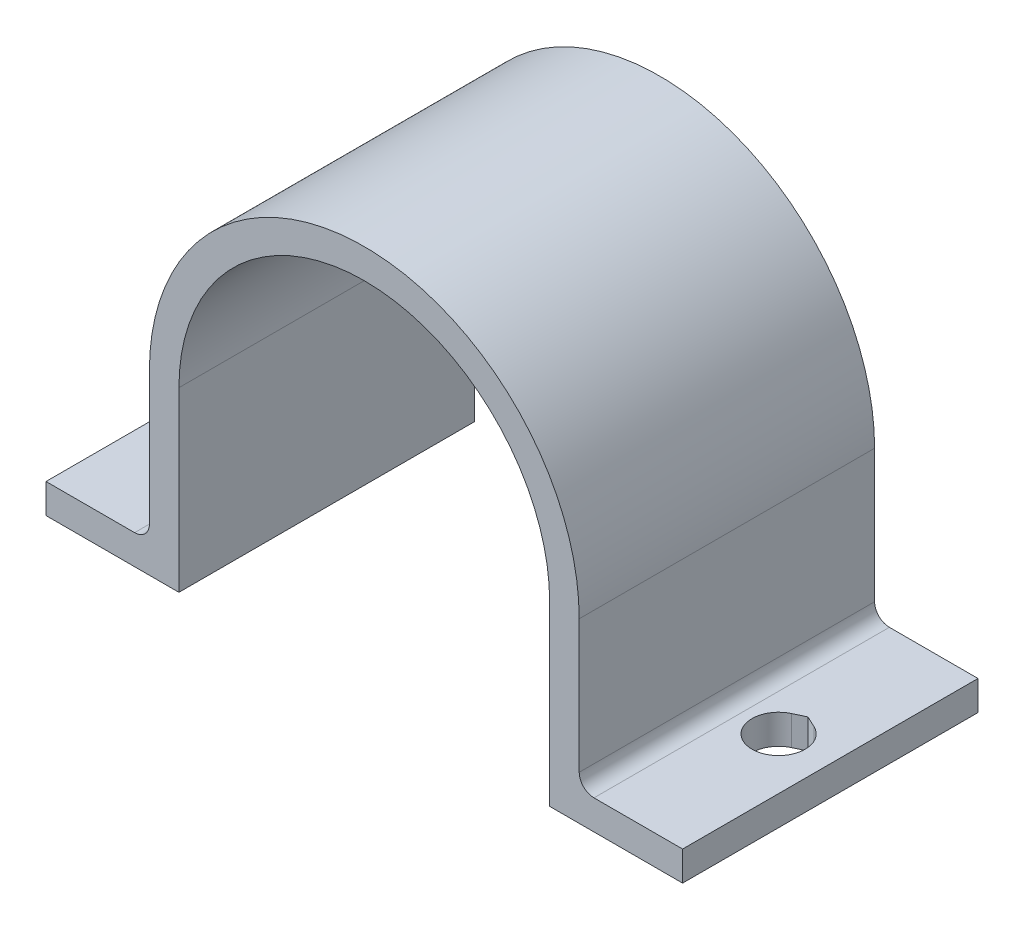
from build123d import *

# Parameters (mm, degrees)
SALIENTE_EXTRUIR1_DEPTH      = 20
TALADRO_DE_MARGEN_PARA_M31_D = 3.6
REDONDEO1_R                  = 1
CORTAR_EXTRUIR1_REACH        = 40.303


with BuildPart() as part:
    # Croquis1 → Saliente-Extruir1 (new body)
    with BuildSketch(Plane.XY):
        with BuildLine():
            Line((-12.55, 0), (-21.55, 0))
            Line((-21.55, 0), (-21.55, 2))
            Line((-21.55, 2), (-14.55, 2))
            Line((-14.55, 2), (-14.55, 12))
            ThreePointArc((-14.55, 12), (0, 26.55), (14.55, 12))
            Line((14.55, 12), (14.55, 2))
            Line((14.55, 2), (21.55, 2))
            Line((21.55, 2), (21.55, 0))
            Line((21.55, 0), (12.55, 0))
            Line((12.55, 0), (12.55, 12))
            ThreePointArc((12.55, 12), (0, 24.55), (-12.55, 12))
            Line((-12.55, 12), (-12.55, 0))
        make_face()
    extrude(amount=SALIENTE_EXTRUIR1_DEPTH)

    # Taladro de margen para M31 (through all)
    with Locations(Plane(origin=(0, 2, 0), x_dir=(1, 0, 0), z_dir=(0, 1, 0))):
        with Locations((18.05, -10), (-18.05, -10)):
            Hole(TALADRO_DE_MARGEN_PARA_M31_D / 2)

    # Redondeo1
    redondeo1_edges = [part.edges().sort_by_distance(p)[0] for p in [
        (14.55, 2, 10),
        (-14.55, 2, 10),
    ]]
    fillet(redondeo1_edges, radius=REDONDEO1_R)

    # Croquis4 → Cortar-Extruir1 (cut, up to next)
    with BuildSketch(Plane(origin=(0, 2, 0), x_dir=(1, 0, 0), z_dir=(0, 1, 0)), mode=Mode.PRIVATE) as cortar_extruir1_sk1:
        with BuildLine():
            Line((-18.815101364, -8.370699567), (-18.05, -8.011416474))
            Line((-18.05, -8.011416474), (-17.284898636, -8.370699567))
            ThreePointArc((-17.284898636, -8.370699567), (-18.05, -8.2), (-18.815101364, -8.370699567))
        make_face()
    cortar_extruir1_tool1 = extrude(cortar_extruir1_sk1.sketch, amount=-CORTAR_EXTRUIR1_REACH, mode=Mode.PRIVATE) & part.part
    cortar_extruir1 = cortar_extruir1_tool1.solids().sort_by_distance((-18.05, 2, 8.160025))[0]
    add(cortar_extruir1, mode=Mode.SUBTRACT)

    # Simetría1: Cortar-Extruir1 across plane
    add(cortar_extruir1.mirror(Plane(origin=(0, 0, 0), x_dir=(0, 0, 1), z_dir=(1, 0, 0))), mode=Mode.SUBTRACT)


solid = part.part
